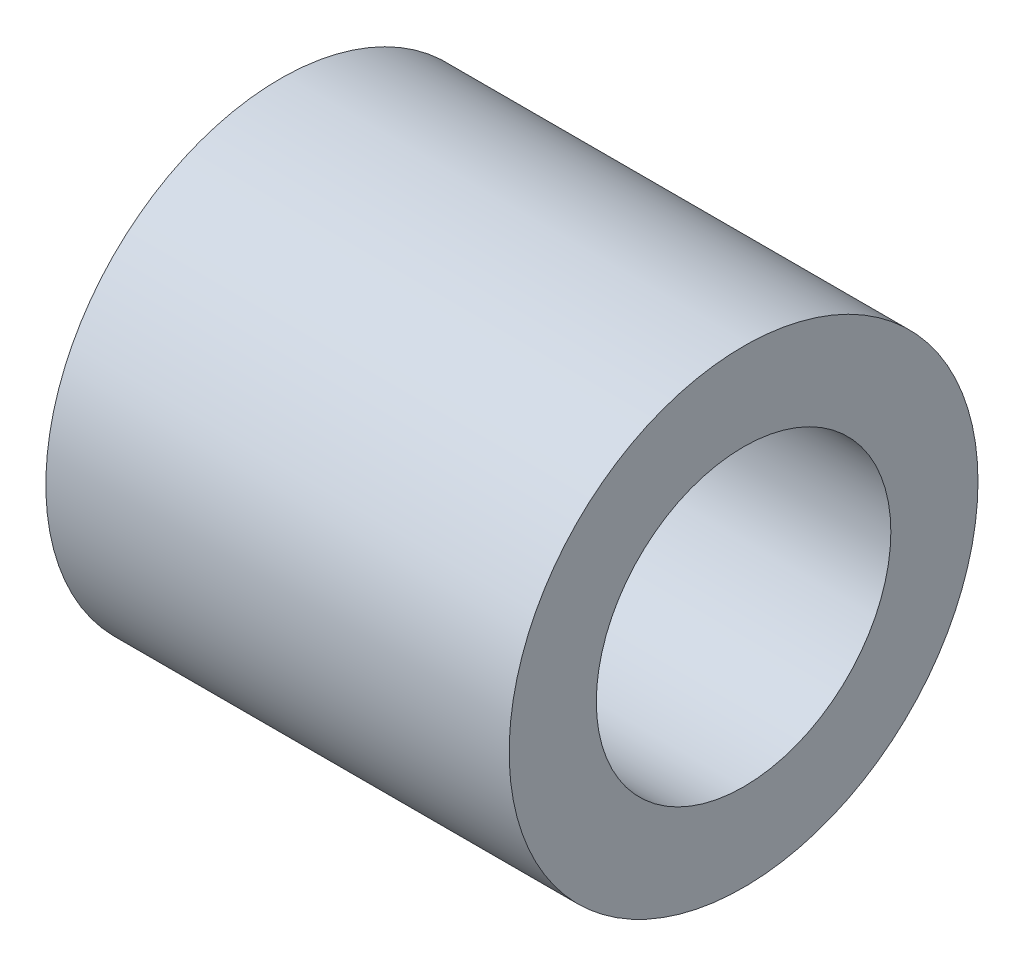
from build123d import *

# Parameters (mm, degrees)
SKETCH1_R           = 5.3975
SKETCH1_R_2         = 3.3909
BOSS_EXTRUDE1_DEPTH = 10.668


with BuildPart() as part:
    # Sketch1 → Boss-Extrude1 (new body)
    with BuildSketch(Plane(origin=(0, 0, 0), x_dir=(0, 0, -1), z_dir=(1, 0, 0))):
        Circle(SKETCH1_R)
        Circle(SKETCH1_R_2, mode=Mode.SUBTRACT)
    extrude(amount=BOSS_EXTRUDE1_DEPTH)


solid = part.part
